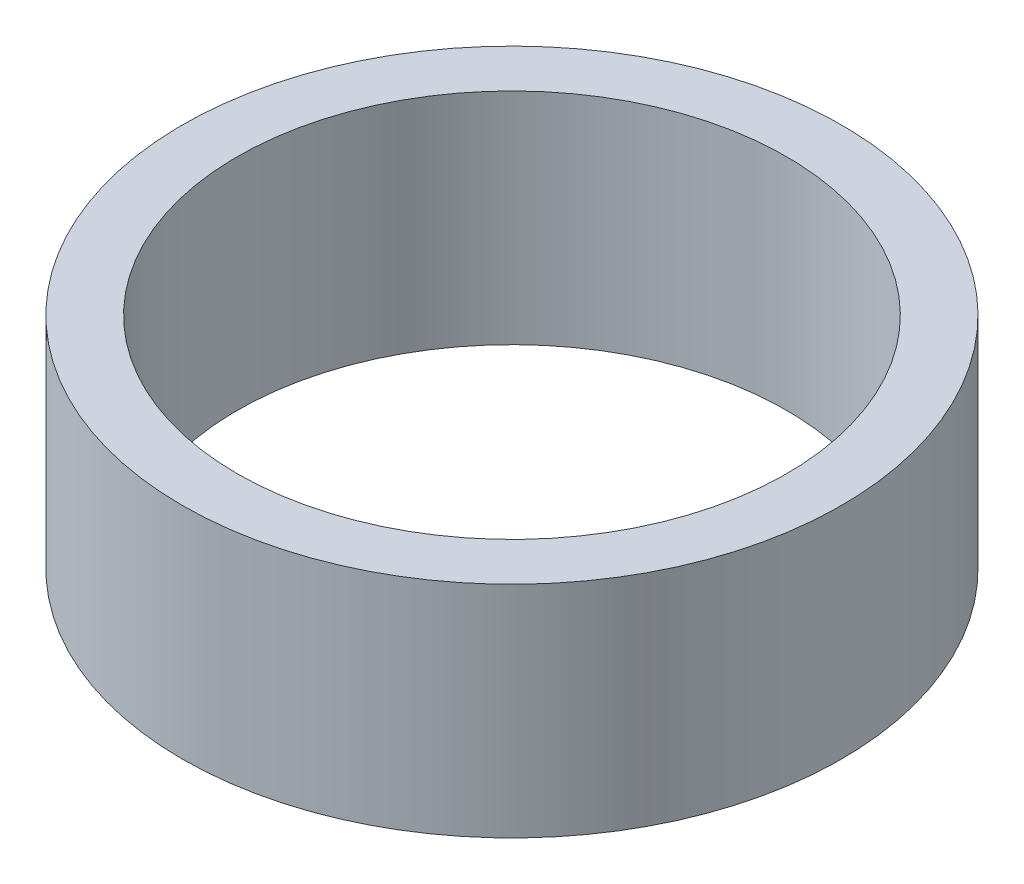
from build123d import *

# Parameters (mm, degrees)
SKETCH1_R           = 0.762
SKETCH1_R_2         = 0.635
BOSS_EXTRUDE1_DEPTH = 0.508


with BuildPart() as part:
    # Sketch1 → Boss-Extrude1 (new body)
    with BuildSketch(Plane(origin=(0, 0, 0), x_dir=(1, 0, 0), z_dir=(0, 1, 0))):
        with Locations(Location((0, 0, 0), (0, 0, 270))):
            Circle(SKETCH1_R)
        with Locations(Location((0, 0, 0), (0, 0, 270))):
            Circle(SKETCH1_R_2, mode=Mode.SUBTRACT)
    extrude(amount=BOSS_EXTRUDE1_DEPTH)


solid = part.part
